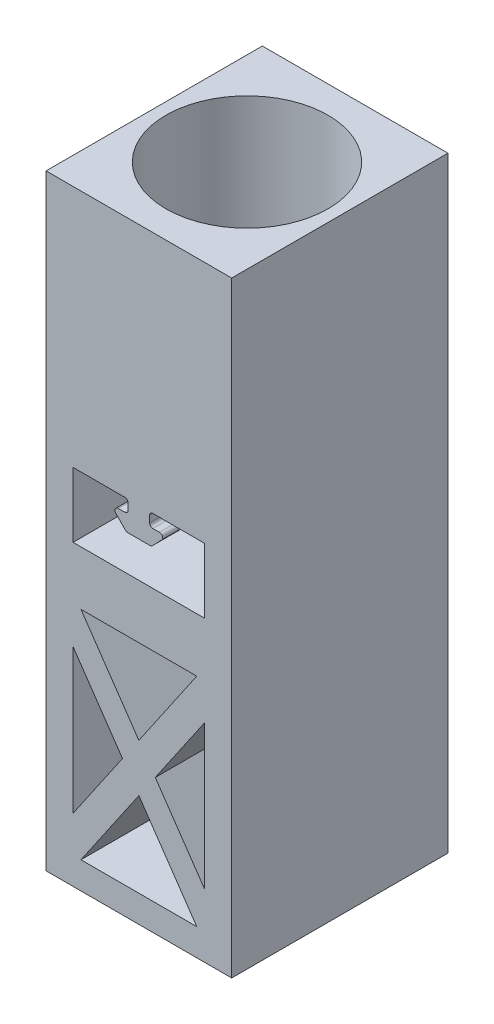
from build123d import *

# Parameters (mm, degrees)
BOSS_EXTRUDE1_DEPTH = 50.8
FILLET1_R           = 0.762
SKETCH2_R           = 19.05
CUT_EXTRUDE1_DEPTH  = 44.45
SKETCH3_R           = 12.7
CUT_EXTRUDE2_DEPTH  = 66.04


with BuildPart() as part:
    # Sketch1 → Boss-Extrude1 (new body)
    with BuildSketch(Plane.XY):
        Polygon((-21.799999961, -13.97), (-21.799999961, 13.97), (-21.799999961, 64.77), (21.799999961, 64.77), (21.799999961, 13.97), (21.799999961, -13.97), (21.799999961, -77.619999954), (-21.799999961, -77.619999954), align=None)
        Polygon((-15.449999961, 7.62), (-2.54, 7.62), (-2.54, 4.572), (-6.6548, 4.572), (-2.933726616, 0.762), (2.933726616, 0.762), (6.6548, 4.572), (2.54, 4.572), (2.54, 7.62), (15.449999961, 7.62), (15.449999961, -7.62), (-15.449999961, -7.62), align=None, mode=Mode.SUBTRACT)
        Polygon((-13.601813914, -20.32), (0, -40.176776526), (13.601813914, -20.32), align=None, mode=Mode.SUBTRACT)
        Polygon((15.449999961, -28.858349607), (3.848460993, -45.794999977), (15.449999961, -62.731650347), align=None, mode=Mode.SUBTRACT)
        Polygon((-3.848460993, -45.794999977), (-15.449999961, -62.731650347), (-15.449999961, -28.858349607), align=None, mode=Mode.SUBTRACT)
        Polygon((0, -51.413223428), (-13.601813914, -71.269999954), (13.601813914, -71.269999954), align=None, mode=Mode.SUBTRACT)
    extrude(amount=BOSS_EXTRUDE1_DEPTH)

    # Fillet1
    fillet1_edges = [part.edges().sort_by_distance(p)[0] for p in [
        (2.54, 7.62, 25.4),
        (2.54, 4.572, 25.4),
        (6.6548, 4.572, 25.4),
        (2.933726616, 0.762, 25.4),
        (-2.933726616, 0.762, 25.4),
        (-6.6548, 4.572, 25.4),
        (-2.54, 4.572, 25.4),
        (-2.54, 7.62, 25.4),
    ]]
    fillet(fillet1_edges, radius=FILLET1_R)

    # Sketch2 → Cut-Extrude1 (cut)
    with BuildSketch(Plane(origin=(0, 64.77, 0), x_dir=(1, 0, 0), z_dir=(0, 1, 0))):
        with Locations(Location((0, -25.4, 0), (0, 0, 270))):
            Circle(SKETCH2_R)
    extrude(amount=-CUT_EXTRUDE1_DEPTH, mode=Mode.SUBTRACT)

    # Sketch3 → Cut-Extrude2 (cut)
    with BuildSketch(Plane(origin=(0, 64.77, 0), x_dir=(1, 0, 0), z_dir=(0, 1, 0))):
        with Locations(Location((0, -25.4, 0), (0, 0, 270))):
            Circle(SKETCH3_R)
    extrude(amount=-CUT_EXTRUDE2_DEPTH, mode=Mode.SUBTRACT)


solid = part.part
